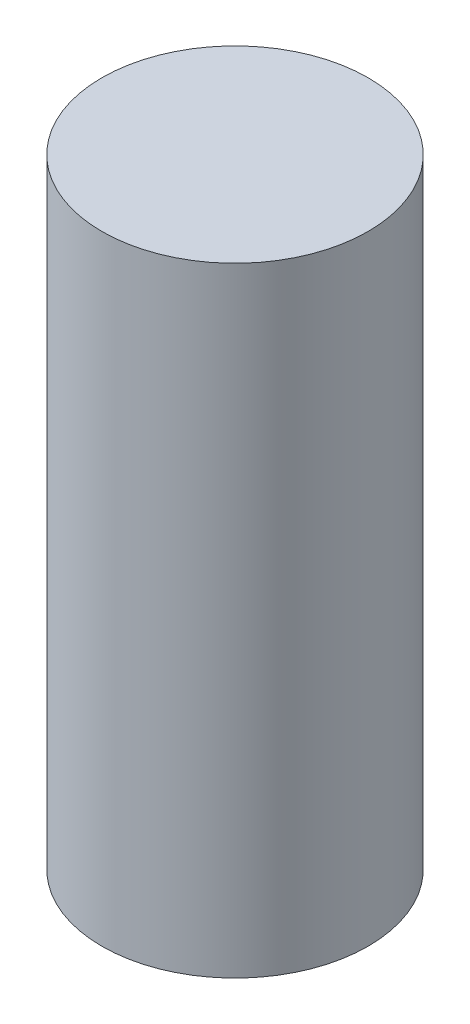
from build123d import *

# Parameters (mm, degrees)
SKETCH1_R           = 32.259100169
BOSS_EXTRUDE1_DEPTH = 150


with BuildPart() as part:
    # Sketch1 → Boss-Extrude1 (new body)
    with BuildSketch(Plane(origin=(0, 0, 0), x_dir=(1, 0, 0), z_dir=(0, 1, 0))):
        with Locations(Location((-13.485361546, 9.783497592, 0), (0, 0, 270))):
            Circle(SKETCH1_R)
    extrude(amount=BOSS_EXTRUDE1_DEPTH)


solid = part.part
